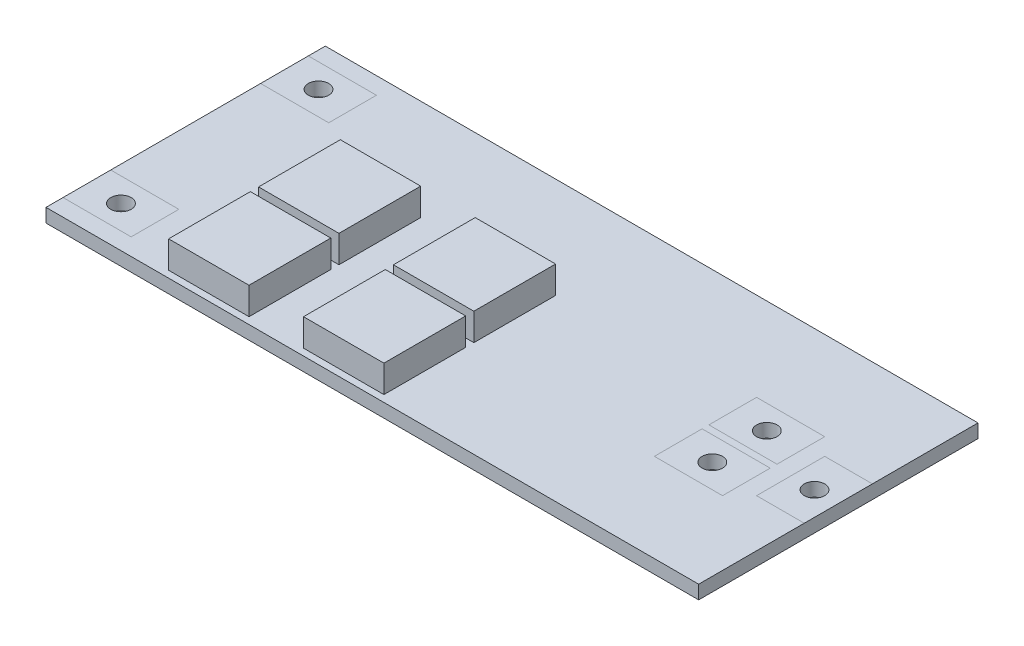
from build123d import *

# Parameters (mm, degrees)
CROQUIS1_W                = 47.9
CROQUIS1_H                = 20.5
CROQUIS1_R                = 0.75
SALIENTE_EXTRUIR1_DEPTH   = 1
CROQUIS2_W                = 5.9
CROQUIS2_H                = 6
SALIENTE_EXTRUIR2_DEPTH   = 2
SALIENTE_EXTRUIR2_2_DEPTH = 2
SALIENTE_EXTRUIR2_3_DEPTH = 2
SALIENTE_EXTRUIR2_4_DEPTH = 2


with BuildPart() as part:
    # Croquis1 → Saliente-Extruir1 (new body)
    with BuildSketch(Plane(origin=(0, 0, 0), x_dir=(1, 0, 0), z_dir=(0, 1, 0))):
        Rectangle(CROQUIS1_W, CROQUIS1_H)
        with Locations(Location((22.2, 0, 0), (0, 0, 270))):
            Circle(CROQUIS1_R, mode=Mode.SUBTRACT)
        with Locations(Location((16.7, 2, 0), (0, 0, 270))):
            Circle(CROQUIS1_R, mode=Mode.SUBTRACT)
        with Locations(Location((-21.45, 7.25, 0), (0, 0, 270))):
            Circle(CROQUIS1_R, mode=Mode.SUBTRACT)
        with Locations(Location((16.7, -2, 0), (0, 0, 90))):
            Circle(CROQUIS1_R, mode=Mode.SUBTRACT)
        with Locations(Location((-21.45, -7.25, 0), (0, 0, 90))):
            Circle(CROQUIS1_R, mode=Mode.SUBTRACT)
    extrude(amount=SALIENTE_EXTRUIR1_DEPTH)


with BuildPart() as body_2:
    # Croquis2 → Saliente-Extruir2 (new body)
    with BuildSketch(Plane(origin=(0, 1, 0), x_dir=(1, 0, 0), z_dir=(0, 1, 0))):
        with Locations((-12.5, -0.15)):
            Rectangle(CROQUIS2_W, CROQUIS2_H)
    extrude(amount=SALIENTE_EXTRUIR2_DEPTH)


with BuildPart() as body_3:
    # Croquis2 → Saliente-Extruir2 2 (new body)
    with BuildSketch(Plane(origin=(0, 1, 0), x_dir=(1, 0, 0), z_dir=(0, 1, 0))):
        with Locations((-12.5, -6.75)):
            Rectangle(CROQUIS2_W, CROQUIS2_H)
    extrude(amount=SALIENTE_EXTRUIR2_2_DEPTH)


with BuildPart() as body_4:
    # Croquis2 → Saliente-Extruir2 3 (new body)
    with BuildSketch(Plane(origin=(0, 1, 0), x_dir=(1, 0, 0), z_dir=(0, 1, 0))):
        with Locations((-2.6, -6.75)):
            Rectangle(CROQUIS2_W, CROQUIS2_H)
    extrude(amount=SALIENTE_EXTRUIR2_3_DEPTH)


with BuildPart() as body_5:
    # Croquis2 → Saliente-Extruir2 4 (new body)
    with BuildSketch(Plane(origin=(0, 1, 0), x_dir=(1, 0, 0), z_dir=(0, 1, 0))):
        with Locations((-2.6, -0.15)):
            Rectangle(CROQUIS2_W, CROQUIS2_H)
    extrude(amount=SALIENTE_EXTRUIR2_4_DEPTH)


solid = Compound([part.part, body_2.part, body_3.part, body_4.part, body_5.part])
